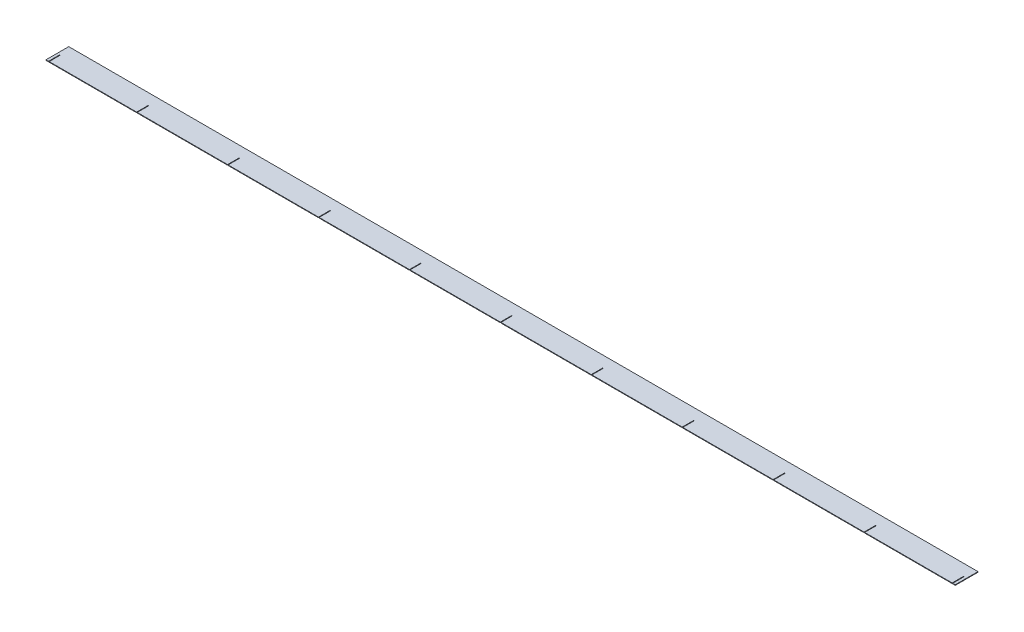
from build123d import *

# Parameters (mm, degrees)
BOSS_EXTRUDE1_DEPTH = 1


with BuildPart() as part:
    # Sketch1 → Boss-Extrude1 (new body)
    with BuildSketch(Plane(origin=(0, 0, 0), x_dir=(1, 0, 0), z_dir=(0, 1, 0))):
        Polygon((-800, 20), (800, 20), (800, -20), (795.5, -20), (795.5, 0), (794.5, 0), (794.5, -20), (640.5, -20), (640.5, 0), (639.5, 0), (639.5, -20), (480.5, -20), (480.5, 0), (479.5, 0), (479.5, -20), (320.5, -20), (320.5, 0), (319.5, 0), (319.5, -20), (160.5, -20), (160.5, 0), (159.5, 0), (159.5, -20), (0.5, -20), (0.5, 0), (-0.5, 0), (-0.5, -20), (-159.5, -20), (-159.5, 0), (-160.5, 0), (-160.5, -20), (-319.5, -20), (-319.5, 0), (-320.5, 0), (-320.5, -20), (-479.5, -20), (-479.5, 0), (-480.5, 0), (-480.5, -20), (-639.5, -20), (-639.5, 0), (-640.5, 0), (-640.5, -20), (-794.5, -20), (-794.5, 0), (-795.5, 0), (-795.5, -20), (-800, -20), align=None)
    extrude(amount=BOSS_EXTRUDE1_DEPTH)


solid = part.part
